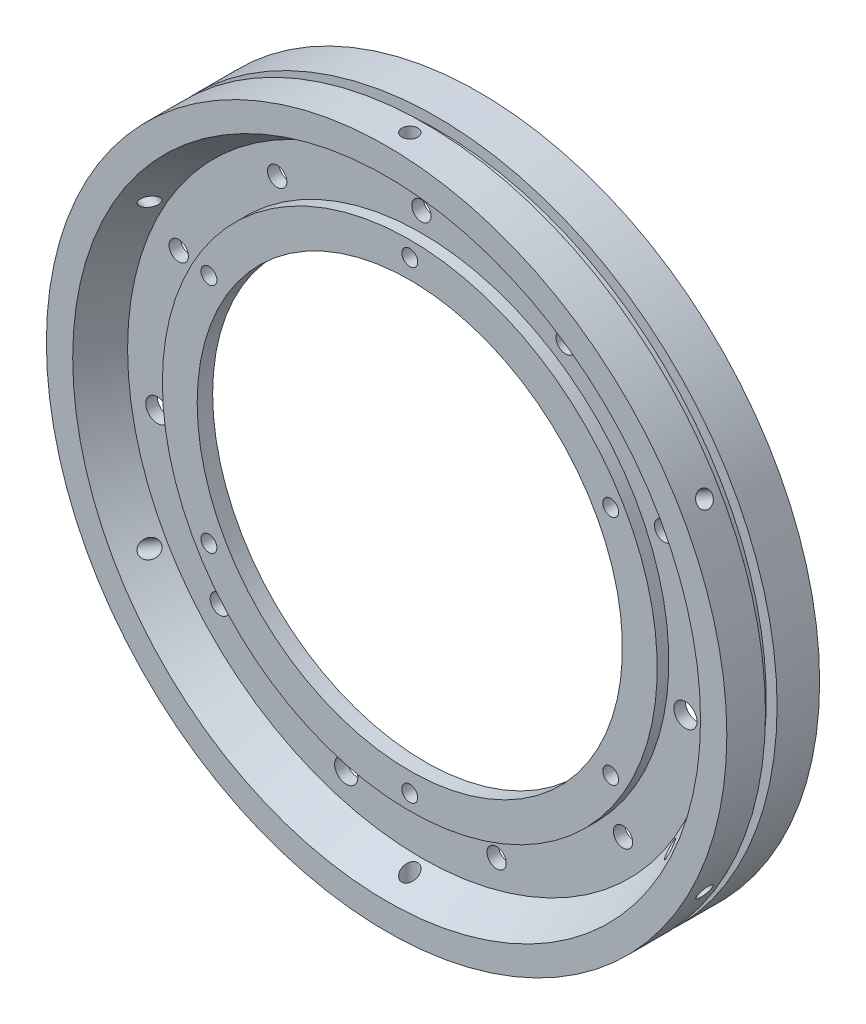
from build123d import *

# Parameters (mm, degrees)
CIRPATTERN1_COUNT            = 6
CIRPATTERN2_COUNT            = 11
F_3_0_3_DIAMETER_HOLE1_D     = 3
F_3_0_3_DIAMETER_HOLE1_DEPTH = 23
F_3_0_3_DIAMETER_HOLE1_TIP   = 0.901290929
CIRPATTERN3_COUNT            = 6


with BuildPart() as part:
    # Sketch1 → Revolve1 (revolve)
    with BuildSketch(Plane(origin=(0, 0, 0), x_dir=(0, 0, -1), z_dir=(1, 0, 0)), mode=Mode.PRIVATE) as revolve1_sk:
        with BuildLine():
            Line((6, 44), (0.5, 44))
            Line((0.5, 44), (0.5, 42.6))
            Line((0.5, 42.6), (-1, 42.6))
            Line((-1, 42.6), (-1, 44))
            Line((-1, 44), (-6, 44))
            Line((-6, 44), (-6, 40.598076211))
            Line((-6, 40.598076211), (-1.5, 38))
            Line((-1.5, 38), (-1.5, 32))
            Line((-1.5, 32), (-3, 32))
            Line((-3, 32), (-3, 27.5))
            Line((-3, 27.5), (-1, 27.5))
            Line((-1, 27.5), (0, 30.247477419))
            Line((0, 30.247477419), (0, 38))
            ThreePointArc((0, 38), (1.757359313, 42.242640687), (6, 44))
        make_face()
    revolve(revolve1_sk.sketch.rotate(Axis((0, 0, 0), (0, 0, 1)), 90), axis=Axis((0, 0, 0), (0, 0, 1)))

    # Sketch2 → M2.5x0.45 Tapped Hole1 (revolve, cut)
    with BuildSketch(Plane(origin=(0, 30, 3), x_dir=(0, -1, 0), z_dir=(1, 0, 0))):
        Polygon((0, 0), (0, 6.965882135), (1.025, 6.35), (1.025, 0), align=None)
    m2_5x0_45_tapped_hole1 = revolve(axis=Axis((0, 30, 9.35), (0, 0, -1)), mode=Mode.SUBTRACT)

    # CirPattern1: M2.5x0.45 Tapped Hole1 ×6 about axis
    cirpattern1_axis = Axis((0, 0, 0), (0, 0, 1))
    for i in range(1, CIRPATTERN1_COUNT):
        add(m2_5x0_45_tapped_hole1.rotate(cirpattern1_axis, i * 360 / CIRPATTERN1_COUNT), mode=Mode.SUBTRACT)

    # Sketch4 → Ø2.5 (2.5) Diameter Hole1 (revolve, cut)
    with BuildSketch(Plane(origin=(0, 34.5, 1.5), x_dir=(0, -1, 0), z_dir=(1, 0, 0))):
        Polygon((0, 0), (0, 23.751075774), (1.25, 23), (1.25, 0), align=None)
    f_2_5_2_5_diameter_hole1 = revolve(axis=Axis((0, 34.5, 7.85), (0, 0, -1)), mode=Mode.SUBTRACT)

    # CirPattern2: Ø2.5 (2.5) Diameter Hole1 ×11 about axis
    cirpattern2_axis = Axis((0, 0, 0), (0, 0, 1))
    for i in range(1, CIRPATTERN2_COUNT):
        add(f_2_5_2_5_diameter_hole1.rotate(cirpattern2_axis, i * 360 / CIRPATTERN2_COUNT), mode=Mode.SUBTRACT)

    # Ø3.0 (3) Diameter Hole1
    with Locations(Plane.XY.offset(1.5)):
        with Locations((-34.148839745, -4.90986192), (-9.719773211, -33.10250759), (34.148839745, -4.90986192)):
            Hole(F_3_0_3_DIAMETER_HOLE1_D / 2, depth=F_3_0_3_DIAMETER_HOLE1_DEPTH)
            with Locations((0, 0, -(F_3_0_3_DIAMETER_HOLE1_DEPTH + F_3_0_3_DIAMETER_HOLE1_TIP / 2))):  # 118° drill point
                Cone(0, F_3_0_3_DIAMETER_HOLE1_D / 2, F_3_0_3_DIAMETER_HOLE1_TIP, mode=Mode.SUBTRACT)

    # Sketch8 → M2.5x0.45 Tapped Hole2 (revolve, cut)
    with BuildSketch(Plane(origin=(0, 44, 3), x_dir=(0, 0, 1), z_dir=(1, 0, 0))):
        Polygon((0, 0), (0, 6.965882135), (1.025, 6.35), (1.025, 0), align=None)
    m2_5x0_45_tapped_hole2 = revolve(axis=Axis((0, 50.35, 3), (0, -1, 0)), mode=Mode.SUBTRACT)

    # CirPattern3: M2.5x0.45 Tapped Hole2 ×6 about axis
    cirpattern3_axis = Axis((0, 0, 6.6), (0, 0, -1))
    for i in range(1, CIRPATTERN3_COUNT):
        add(m2_5x0_45_tapped_hole2.rotate(cirpattern3_axis, i * 360 / CIRPATTERN3_COUNT), mode=Mode.SUBTRACT)


solid = part.part
